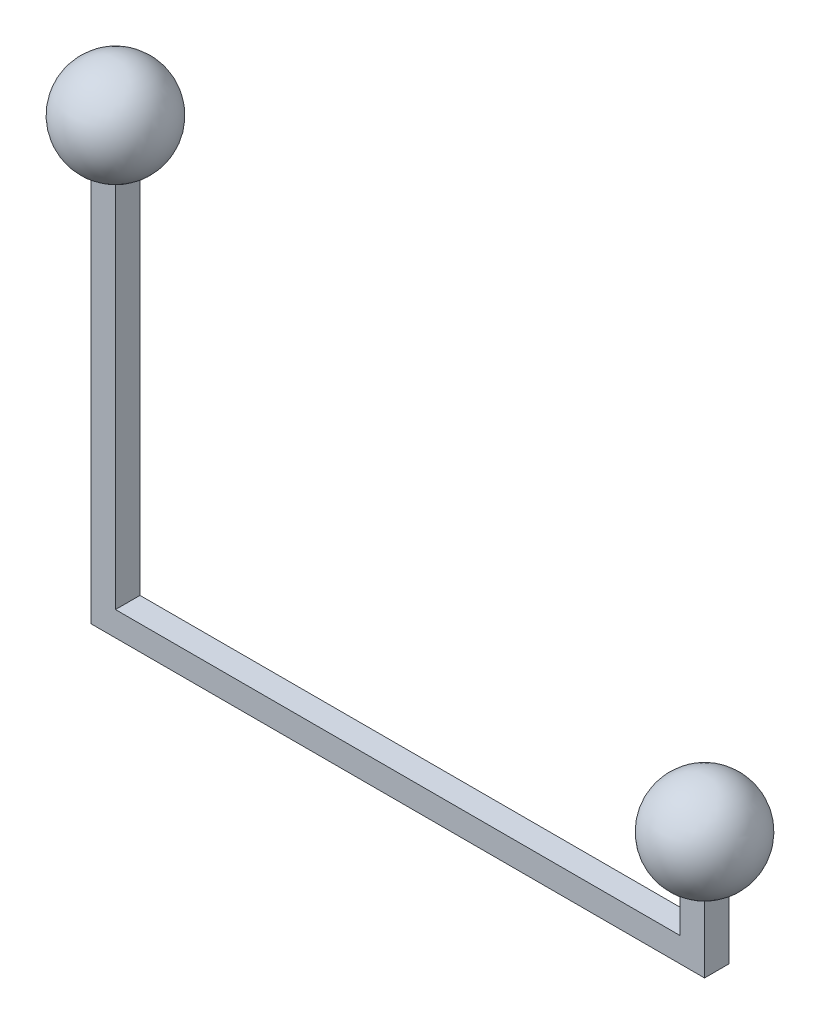
from build123d import *

# Parameters (mm, degrees)
BOSS_EXTRUDE1_DEPTH = 3.175


with BuildPart() as part:
    # Sketch1 → Boss-Extrude1 (new body)
    with BuildSketch(Plane.XY):
        Polygon((0, 0), (79.375, 0), (79.375, 8.638996592), (76.2, 8.638996592), (76.2, 3.175), (3.175, 3.175), (3.175, 50.8), (0, 50.8), align=None)
    extrude(amount=BOSS_EXTRUDE1_DEPTH)

    # Sketch2 → Revolve1 (revolve)
    with BuildSketch(Plane.XY.offset(1.5875)):
        with BuildLine():
            Line((1.5875, 50.598361062), (1.5875, 63.298361062))
            ThreePointArc((1.5875, 63.298361062), (7.9375, 56.948361062), (1.5875, 50.598361062))
        make_face()
    revolve(axis=Axis((1.5875, 50.598361062, 1.5875), (0, 1, 0)))

    # Sketch3 → Revolve2 (revolve)
    with BuildSketch(Plane.XY.offset(1.5875)):
        with BuildLine():
            Line((77.7875, 21.137357655), (77.7875, 8.437357655))
            ThreePointArc((77.7875, 8.437357655), (84.1375, 14.787357655), (77.7875, 21.137357655))
        make_face()
    revolve(axis=Axis((77.7875, 21.137357655, 1.5875), (0, -1, 0)))


solid = part.part
